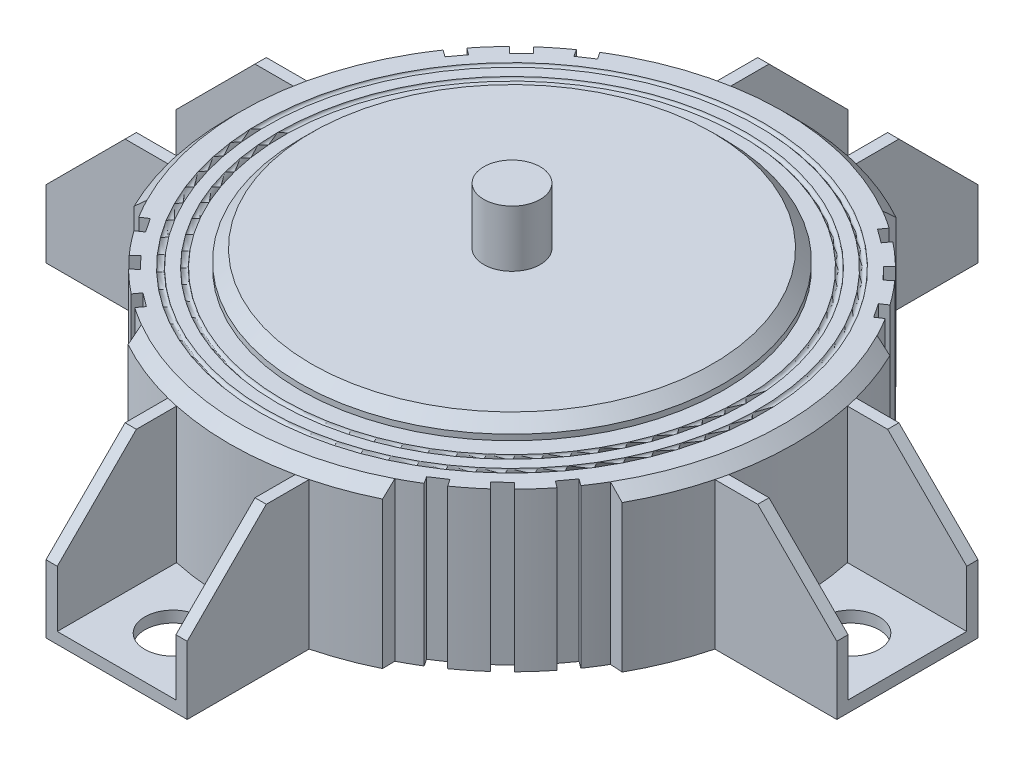
from build123d import *

# Parameters (mm, degrees)
CHAMFER1_SIZE                   = 2
BOSS_EXTRUDE1_DEPTH             = 70
CHAMFER2_SIZE                   = 14
SKETCH3_R                       = 5
CUT_EXTRUDE1_DEPTH              = 70
CIRPATTERN1_COUNT               = 4
CHAMFER2_OF_CIRPATTERN1_SIZE    = 14
CUT_EXTRUDE2_START              = 70
CUT_EXTRUDE2_DEPTH              = 70
CUT_EXTRUDE3_DEPTH              = 70
CIRPATTERN2_COUNT               = 2
CIRPATTERN2_ANGLE               = 10
CIRPATTERN2_THE_OTHER_WAY_COUNT = 2
CIRPATTERN2_THE_OTHER_WAY_ANGLE = 10
CIRPATTERN3_COUNT               = 4
CIRPATTERN3_COPY_1_DEPTH        = 70
CIRPATTERN3_COPY_2_DEPTH        = 70
CIRPATTERN3_COPY_3_DEPTH        = 70
CIRPATTERN3_COPY_4_DEPTH        = 70
CIRPATTERN3_COPY_5_DEPTH        = 70
CIRPATTERN3_COPY_6_DEPTH        = 70
CUT_SWEEP1_PROFILE_R            = 0.5
CUT_SWEEP2_PROFILE_R            = 0.5
CUT_EXTRUDE4_START              = -10
SKETCH16_R                      = 37.5
CUT_EXTRUDE4_DEPTH              = 10


with BuildPart() as part:
    # Sketch1 → Revolve1 (revolve)
    with BuildSketch(Plane.XY, mode=Mode.PRIVATE) as revolve1_sk:
        Polygon((0, 0), (-50, 0), (-50, 28), (-37.5, 28), (-37.5, 31), (-5, 31), (-5, 41), (0, 41), align=None)
    revolve(revolve1_sk.sketch.rotate(Axis((0, 0, 0), (0, 1, 0)), 270), axis=Axis((0, 0, 0), (0, 1, 0)))

    # Chamfer1
    chamfer1_edges = [part.edges().sort_by_distance(p)[0] for p in [
        (0, 31, 37.5),
        (0, 28, 50),
    ]]
    chamfer(chamfer1_edges, length=CHAMFER1_SIZE)

    # Sketch2 → Boss-Extrude1 (add)
    with BuildSketch(Plane.XY):
        Polygon((-12.5, 26), (-12.5, 0), (12.5, 0), (12.5, 26), (10.5, 26), (10.5, 2), (-10.5, 2), (-10.5, 26), align=None)
    boss_extrude1 = extrude(amount=BOSS_EXTRUDE1_DEPTH)

    # Chamfer2
    chamfer2_edges = [part.edges().sort_by_distance(p)[0] for p in [
        (-11.5, 26, 70),
        (11.5, 26, 70),
    ]]
    chamfer(chamfer2_edges, length=CHAMFER2_SIZE)

    # Sketch3 → Cut-Extrude1 (cut)
    with BuildSketch(Plane(origin=(0, 0, 0), x_dir=(1, 0, 0), z_dir=(0, 1, 0))):
        with Locations(Location((0, -60, 0), (0, 0, 90))):
            Circle(SKETCH3_R)
    cut_extrude1 = extrude(amount=CUT_EXTRUDE1_DEPTH, mode=Mode.SUBTRACT)

    # CirPattern1: Boss-Extrude1, Cut-Extrude1 ×4 about axis
    cirpattern1_axis = Axis((0, 0, 0), (0, 1, 0))
    add([boss_extrude1.rotate(cirpattern1_axis, i * 360 / CIRPATTERN1_COUNT) for i in range(1, CIRPATTERN1_COUNT)])
    add([cut_extrude1.rotate(cirpattern1_axis, i * 360 / CIRPATTERN1_COUNT) for i in range(1, CIRPATTERN1_COUNT)], mode=Mode.SUBTRACT)

    # Chamfer2 of CirPattern1
    chamfer2_of_cirpattern1_edges = [part.edges().sort_by_distance(p)[0] for p in [
        (70, 26, 11.5),
        (70, 26, -11.5),
        (11.5, 26, -70),
        (-11.5, 26, -70),
        (-70, 26, -11.5),
        (-70, 26, 11.5),
    ]]
    chamfer(chamfer2_of_cirpattern1_edges, length=CHAMFER2_OF_CIRPATTERN1_SIZE)

    # Sketch4 → Cut-Extrude2 (cut)
    with BuildSketch(Plane(origin=(0, 0, 0), x_dir=(1, 0, 0), z_dir=(0, 1, 0)).offset(CUT_EXTRUDE2_START)):
        with BuildLine():
            Line((21.951196001, -42.686590332), (21.990145173, -44.904715958))
            ThreePointArc((21.990145173, -44.904715958), (34.448676313, -36.239325329), (43.73374037, -24.23551017))
            Line((43.73374037, -24.23551017), (41.520431678, -24.084305123))
            ThreePointArc((41.520431678, -24.084305123), (33.07072926, -34.789752316), (21.951196001, -42.686590332))
        make_face()
    cut_extrude2 = extrude(amount=-CUT_EXTRUDE2_DEPTH, mode=Mode.SUBTRACT)

    # Sketch5 → Cut-Extrude3 (cut)
    with BuildSketch(Plane(origin=(0, 0, 0), x_dir=(1, 0, 0), z_dir=(0, 1, 0))):
        Polygon((33.01700979, -36.910392365), (35.191369309, -34.843471786), (33.124448731, -32.669112267), (30.950089211, -34.736032845), align=None)
    cut_extrude3 = extrude(amount=CUT_EXTRUDE3_DEPTH, mode=Mode.SUBTRACT)

    # CirPattern2: Cut-Extrude3 ×2 about axis
    cirpattern2_axis = Axis((0, 0, 0), (0, 1, 0))
    for i in range(1, CIRPATTERN2_COUNT):
        add(cut_extrude3.rotate(cirpattern2_axis, i * CIRPATTERN2_ANGLE / (CIRPATTERN2_COUNT - 1)), mode=Mode.SUBTRACT)

    # CirPattern2 the other way: Cut-Extrude3 ×2 about axis
    cirpattern2_the_other_way_axis = Axis((0, 0, 0), (0, -1, 0))
    for i in range(1, CIRPATTERN2_THE_OTHER_WAY_COUNT):
        add(cut_extrude3.rotate(cirpattern2_the_other_way_axis, i * CIRPATTERN2_THE_OTHER_WAY_ANGLE / (CIRPATTERN2_THE_OTHER_WAY_COUNT - 1)), mode=Mode.SUBTRACT)

    # CirPattern3: Cut-Extrude2, Cut-Extrude3 ×4 about axis
    cirpattern3_axis = Axis((0, 0, 0), (0, 1, 0))
    add([cut_extrude2.rotate(cirpattern3_axis, i * 360 / CIRPATTERN3_COUNT) for i in range(1, CIRPATTERN3_COUNT)], mode=Mode.SUBTRACT)
    add([cut_extrude3.rotate(cirpattern3_axis, i * 360 / CIRPATTERN3_COUNT) for i in range(1, CIRPATTERN3_COUNT)], mode=Mode.SUBTRACT)

    # CirPattern3 copy 1 sketch → CirPattern3 copy 1 (cut)
    with BuildSketch(Plane(origin=(0, 0, 0), x_dir=(-0.17364817766693091, 0, -0.9848077530122079), z_dir=(0, 1, 0))):
        Polygon((33.01700979, -36.910392365), (35.191369309, -34.843471786), (33.124448731, -32.669112267), (30.950089211, -34.736032845), align=None)
    extrude(amount=CIRPATTERN3_COPY_1_DEPTH, mode=Mode.SUBTRACT)

    # CirPattern3 copy 2 sketch → CirPattern3 copy 2 (cut)
    with BuildSketch(Plane(origin=(0, 0, 0), x_dir=(-0.9848077530122079, 0, 0.17364817766693086), z_dir=(0, 1, 0))):
        Polygon((33.01700979, -36.910392365), (35.191369309, -34.843471786), (33.124448731, -32.669112267), (30.950089211, -34.736032845), align=None)
    extrude(amount=CIRPATTERN3_COPY_2_DEPTH, mode=Mode.SUBTRACT)

    # CirPattern3 copy 3 sketch → CirPattern3 copy 3 (cut)
    with BuildSketch(Plane(origin=(0, 0, 0), x_dir=(0.17364817766693078, 0, 0.9848077530122079), z_dir=(0, 1, 0))):
        Polygon((33.01700979, -36.910392365), (35.191369309, -34.843471786), (33.124448731, -32.669112267), (30.950089211, -34.736032845), align=None)
    extrude(amount=CIRPATTERN3_COPY_3_DEPTH, mode=Mode.SUBTRACT)

    # CirPattern3 copy 4 sketch → CirPattern3 copy 4 (cut)
    with BuildSketch(Plane(origin=(0, 0, 0), x_dir=(0.17364817766693103, 0, -0.9848077530122079), z_dir=(0, 1, 0))):
        Polygon((33.01700979, -36.910392365), (35.191369309, -34.843471786), (33.124448731, -32.669112267), (30.950089211, -34.736032845), align=None)
    extrude(amount=CIRPATTERN3_COPY_4_DEPTH, mode=Mode.SUBTRACT)

    # CirPattern3 copy 5 sketch → CirPattern3 copy 5 (cut)
    with BuildSketch(Plane(origin=(0, 0, 0), x_dir=(-0.9848077530122079, 0, -0.17364817766693108), z_dir=(0, 1, 0))):
        Polygon((33.01700979, -36.910392365), (35.191369309, -34.843471786), (33.124448731, -32.669112267), (30.950089211, -34.736032845), align=None)
    extrude(amount=CIRPATTERN3_COPY_5_DEPTH, mode=Mode.SUBTRACT)

    # CirPattern3 copy 6 sketch → CirPattern3 copy 6 (cut)
    with BuildSketch(Plane(origin=(0, 0, 0), x_dir=(-0.17364817766693116, 0, 0.9848077530122079), z_dir=(0, 1, 0))):
        Polygon((33.01700979, -36.910392365), (35.191369309, -34.843471786), (33.124448731, -32.669112267), (30.950089211, -34.736032845), align=None)
    extrude(amount=CIRPATTERN3_COPY_6_DEPTH, mode=Mode.SUBTRACT)

    # Cut-Sweep1: sweep along a path in Sketch6
    with BuildLine(Plane(origin=(0, 28, 0), x_dir=(1, 0, 0), z_dir=(0, 1, 0))) as cut_sweep1_path:
        CenterArc((0, 0), 41, 0, 360)
    # Cut-Sweep1 profile (on start of the path) → Cut-Sweep1 (sweep, cut)
    with BuildSketch(Plane(origin=(41, 28, 0), x_dir=(-1, 0, 0), z_dir=(0, 0, -1))):
        Circle(CUT_SWEEP1_PROFILE_R)
    sweep(path=cut_sweep1_path.line, mode=Mode.SUBTRACT)

    # Cut-Sweep2: sweep along a path in Sketch7
    with BuildLine(Plane(origin=(0, 28, 0), x_dir=(1, 0, 0), z_dir=(0, 1, 0))) as cut_sweep2_path:
        CenterArc((0, 0), 44, 0, 360)
    # Cut-Sweep2 profile (on start of the path) → Cut-Sweep2 (sweep, cut)
    with BuildSketch(Plane(origin=(44, 28, 0), x_dir=(-1, 0, 0), z_dir=(0, 0, -1))):
        Circle(CUT_SWEEP2_PROFILE_R)
    sweep(path=cut_sweep2_path.line, mode=Mode.SUBTRACT)

    # Sketch16 → Cut-Extrude4 (cut)
    with BuildSketch(Plane.XZ.offset(CUT_EXTRUDE4_START)):
        with Locations(Location((0, 0, 0), (0, 0, 270))):
            Circle(SKETCH16_R)
    extrude(amount=CUT_EXTRUDE4_DEPTH, mode=Mode.SUBTRACT)


solid = part.part
